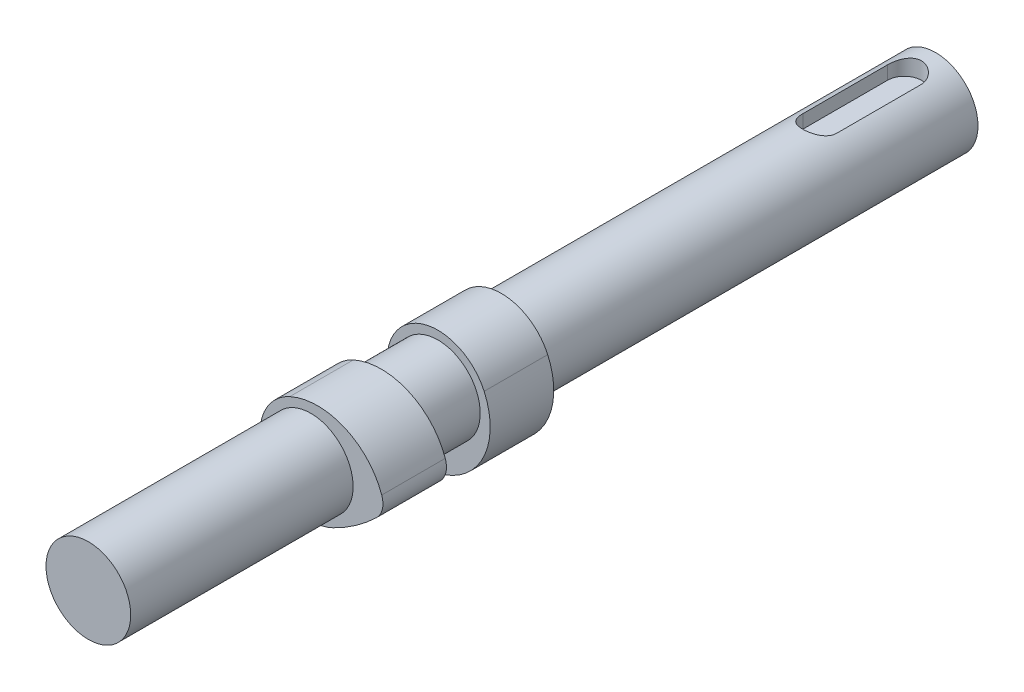
from build123d import *

# Parameters (mm, degrees)
SKETCH1_R           = 10
BOSS_EXTRUDE1_DEPTH = 200
CUT_EXTRUDE1_DEPTH  = 201.888028513
BOSS_EXTRUDE2_DEPTH = 7.5
BOSS_EXTRUDE3_DEPTH = 7.5


with BuildPart() as part:
    # Sketch1 → Boss-Extrude1 (new body)
    with BuildSketch(Plane.XY):
        Circle(SKETCH1_R)
    extrude(amount=BOSS_EXTRUDE1_DEPTH)

    # Sketch2 → Cut-Extrude1 (cut, through all)
    with BuildSketch(Plane(origin=(0, 6, 0), x_dir=(1, 0, 0), z_dir=(0, 1, 0))):
        with BuildLine():
            Line((4, -7.366085137), (4, -27.366085137))
            ThreePointArc((4, -27.366085137), (0, -31.366085137), (-4, -27.366085137))
            Line((-4, -27.366085137), (-4, -7.366085137))
            ThreePointArc((-4, -7.366085137), (0, -3.366085137), (4, -7.366085137))
        make_face()
    extrude(amount=CUT_EXTRUDE1_DEPTH, mode=Mode.SUBTRACT)

    # Sketch3 → Boss-Extrude2 (add, symmetric)
    with BuildSketch(Plane.XY.offset(140)):
        with BuildLine():
            ThreePointArc((-4.952730673, 10.930254292), (-10.854939686, -5.115690024), (5.277504453, -10.777195681))
            ThreePointArc((5.277504453, -10.777195681), (10.675038927, -7.586922797), (15.50773958, -3.59239856))
            ThreePointArc((15.50773958, -3.59239856), (16.896032107, -1.149665837), (16.74776808, 1.656099135))
            ThreePointArc((16.74776808, 1.656099135), (7.938689804, 11.069291645), (-4.952730673, 10.930254292))
        make_face()
    extrude(amount=BOSS_EXTRUDE2_DEPTH, both=True)

    # Sketch4 → Boss-Extrude3 (add, symmetric)
    with BuildSketch(Plane.XY.offset(110)):
        with BuildLine():
            ThreePointArc((10.930254292, 4.952730673), (-5.115690024, 10.854939686), (-10.777195681, -5.277504453))
            ThreePointArc((-10.777195681, -5.277504453), (-7.586922797, -10.675038927), (-3.59239856, -15.50773958))
            ThreePointArc((-3.59239856, -15.50773958), (-1.149665837, -16.896032107), (1.656099135, -16.74776808))
            ThreePointArc((1.656099135, -16.74776808), (11.069291645, -7.938689804), (10.930254292, 4.952730673))
        make_face()
    extrude(amount=BOSS_EXTRUDE3_DEPTH, both=True)


solid = part.part
